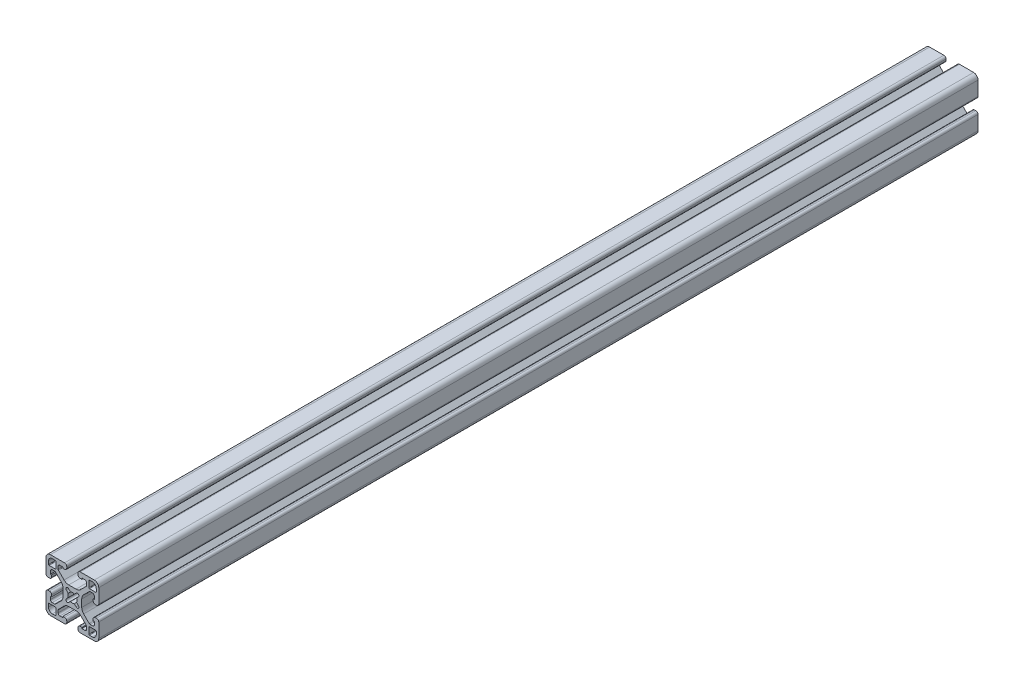
from build123d import *

# Parameters (mm, degrees)
BOSS_EXTRUDE1_DEPTH     = 317.5
CUT_EXTRUDE1_DEPTH      = 319.640949973
CUT_EXTRUDE1_DEPTH_BACK = 319.640949973


with BuildPart() as part:
    # Sketch4 → Boss-Extrude1 (new, symmetric)
    with BuildSketch(Plane.XY):
        with BuildLine():
            Line((2.729997861, -4.346443963), (1.401430967, -3.017877069))
            ThreePointArc((1.401430967, -3.017877069), (0.717602467, -3.249097946), (0, -3.3274))
            Line((0, -3.3274), (0, -6.7564))
            Line((0, -6.7564), (2.633706952, -6.7564))
            ThreePointArc((2.633706952, -6.7564), (4.451376719, -7.117956996), (5.992322742, -8.147584211))
            Line((5.992322742, -8.147584211), (10.026617928, -12.181879398))
            ThreePointArc((10.026617928, -12.181879398), (10.219328904, -12.470291755), (10.287, -12.810497326))
            Line((10.287, -12.810497326), (10.287, -14.5542))
            ThreePointArc((10.287, -14.5542), (9.915025612, -15.452225612), (9.017, -15.8242))
            Line((9.017, -15.8242), (6.858, -15.8242))
            Line((6.858, -15.8242), (6.858, -14.986))
            Line((6.858, -14.986), (5.6388, -14.986))
            ThreePointArc((5.6388, -14.986), (4.525248241, -15.447248241), (4.064, -16.5608))
            Line((4.064, -16.5608), (4.064, -17.4752))
            ThreePointArc((4.064, -17.4752), (4.525248241, -18.588751759), (5.6388, -19.05))
            Line((5.6388, -19.05), (15.875, -19.05))
            ThreePointArc((15.875, -19.05), (18.12006403, -18.12006403), (19.05, -15.875))
            Line((19.05, -15.875), (19.05, -5.6388))
            ThreePointArc((19.05, -5.6388), (18.588751759, -4.525248241), (17.4752, -4.064))
            Line((17.4752, -4.064), (16.5608, -4.064))
            ThreePointArc((16.5608, -4.064), (15.447248241, -4.525248241), (14.986, -5.6388))
            Line((14.986, -5.6388), (14.986, -6.858))
            Line((14.986, -6.858), (15.8242, -6.858))
            Line((15.8242, -6.858), (15.8242, -9.017))
            ThreePointArc((15.8242, -9.017), (15.452225612, -9.915025612), (14.5542, -10.287))
            Line((14.5542, -10.287), (12.810497326, -10.287))
            ThreePointArc((12.810497326, -10.287), (12.470291755, -10.219328904), (12.181879398, -10.026617928))
            Line((12.181879398, -10.026617928), (8.147584211, -5.992322742))
            ThreePointArc((8.147584211, -5.992322742), (7.117956996, -4.451376719), (6.7564, -2.633706952))
            Line((6.7564, -2.633706952), (6.7564, 0))
            Line((6.7564, 0), (3.3274, 0))
            ThreePointArc((3.3274, 0), (3.249097946, -0.717602467), (3.017877069, -1.401430967))
            Line((3.017877069, -1.401430967), (4.346443963, -2.729997861))
            ThreePointArc((4.346443963, -2.729997861), (4.346443963, -4.346443963), (2.729997861, -4.346443963))
        make_face()
    extrude(amount=BOSS_EXTRUDE1_DEPTH, both=True)

    # Sketch5 → Cut-Extrude1 (cut, two sides: drawn at the far end of the back side and taken through both)
    with BuildSketch(Plane.XY.offset(-CUT_EXTRUDE1_DEPTH_BACK)):
        with BuildLine():
            Line((16.8656, -11.8618), (12.2428, -11.8618))
            ThreePointArc((12.2428, -11.8618), (11.973392316, -11.973392316), (11.8618, -12.2428))
            Line((11.8618, -12.2428), (11.8618, -16.8656))
            ThreePointArc((11.8618, -16.8656), (11.973392316, -17.135007684), (12.2428, -17.2466))
            Line((12.2428, -17.2466), (14.4526, -17.2466))
            ThreePointArc((14.4526, -17.2466), (16.428256347, -16.428256347), (17.2466, -14.4526))
            Line((17.2466, -14.4526), (17.2466, -12.2428))
            ThreePointArc((17.2466, -12.2428), (17.135007684, -11.973392316), (16.8656, -11.8618))
        make_face()
    extrude(amount=CUT_EXTRUDE1_DEPTH + CUT_EXTRUDE1_DEPTH_BACK, mode=Mode.SUBTRACT)

    # Mirror1: part across plane


with BuildPart() as part_1:
    add(part.part)
    add(part.part.mirror(Plane(origin=(0, 0, 0), x_dir=(0, 0, 1), z_dir=(1, 0, 0))))

    # Mirror2: part across plane


with BuildPart() as part_2:
    add(part_1.part)
    add(part_1.part.mirror(Plane.ZX))


solid = part_2.part
